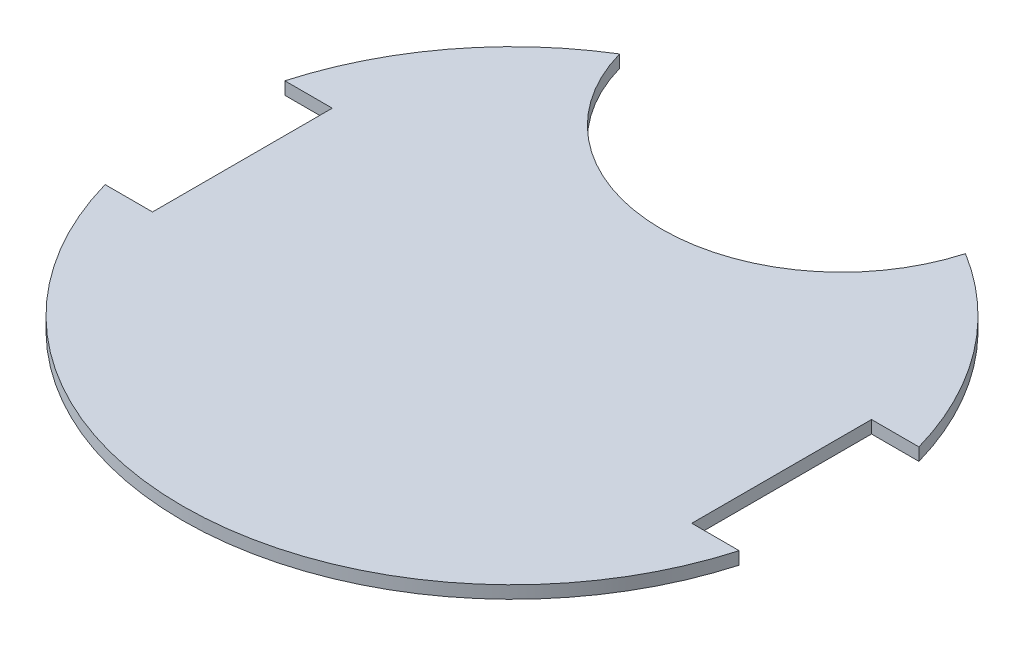
from build123d import *

# Parameters (mm, degrees)
SKETCH2_W           = 279.4
SKETCH2_H           = 279.4
BOSS_EXTRUDE1_DEPTH = 5.334
SKETCH3_OUTSIDE_W   = 360.434
SKETCH3_OUTSIDE_H   = 360.434
CUT_EXTRUDE1_DEPTH  = 198.637626873
SKETCH4_W           = 50.8
SKETCH4_H           = 76.2
CUT_EXTRUDE2_DEPTH  = 198.637626873


with BuildPart() as part:
    # Sketch2 → Boss-Extrude1 (new body)
    with BuildSketch(Plane(origin=(0, 0, 0), x_dir=(1, 0, 0), z_dir=(0, 1, 0))):
        Rectangle(SKETCH2_W, SKETCH2_H)
    extrude(amount=BOSS_EXTRUDE1_DEPTH)

    # Sketch3 outside → Cut-Extrude1 (cut, through all)
    with BuildSketch(Plane(origin=(0, 5.334, 0), x_dir=(1, 0, 0), z_dir=(0, 1, 0))):
        Rectangle(SKETCH3_OUTSIDE_W, SKETCH3_OUTSIDE_H)
        with BuildLine():
            ThreePointArc((-73.311363601, 118.918181818), (0, -139.7), (73.311363601, 118.918181818))
            ThreePointArc((73.311363601, 118.918181818), (0, 63.5), (-73.311363601, 118.918181818))
        make_face(mode=Mode.SUBTRACT)
    extrude(amount=-CUT_EXTRUDE1_DEPTH, mode=Mode.SUBTRACT)

    # Sketch4 → Cut-Extrude2 (cut, through all)
    with BuildSketch(Plane(origin=(0, 5.334, 0), x_dir=(1, 0, 0), z_dir=(0, 1, 0))):
        with Locations((-139.7, 0)):
            Rectangle(SKETCH4_W, SKETCH4_H)
        with Locations((139.7, 0)):
            Rectangle(SKETCH4_W, SKETCH4_H)
    extrude(amount=-CUT_EXTRUDE2_DEPTH, mode=Mode.SUBTRACT)


solid = part.part
